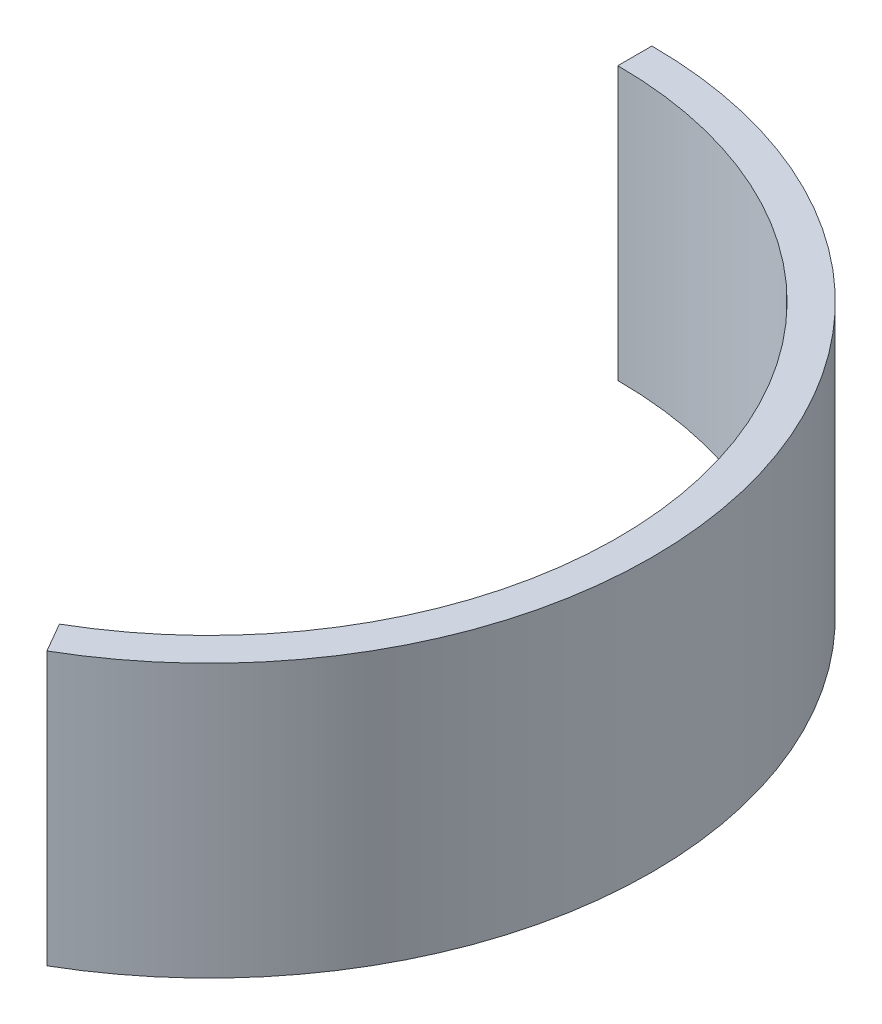
from build123d import *

# Parameters (mm, degrees)
BOSS_EXTRUDE1_DEPTH = 25.4


with BuildPart() as part:
    # Sketch1 → Boss-Extrude1 (new body)
    with BuildSketch(Plane(origin=(0, 0, 0), x_dir=(1, 0, 0), z_dir=(0, 1, 0))):
        with BuildLine():
            Line((19.03857, -71.052910543), (20.62607, -73.8025412))
            ThreePointArc((20.62607, -73.8025412), (39.846507416, -27.400300517), (0, 3.175))
            Line((0, 3.175), (0, 0))
            ThreePointArc((0, 0), (36.779692917, -28.222050985), (19.03857, -71.052910543))
        make_face()
    extrude(amount=BOSS_EXTRUDE1_DEPTH)


solid = part.part
